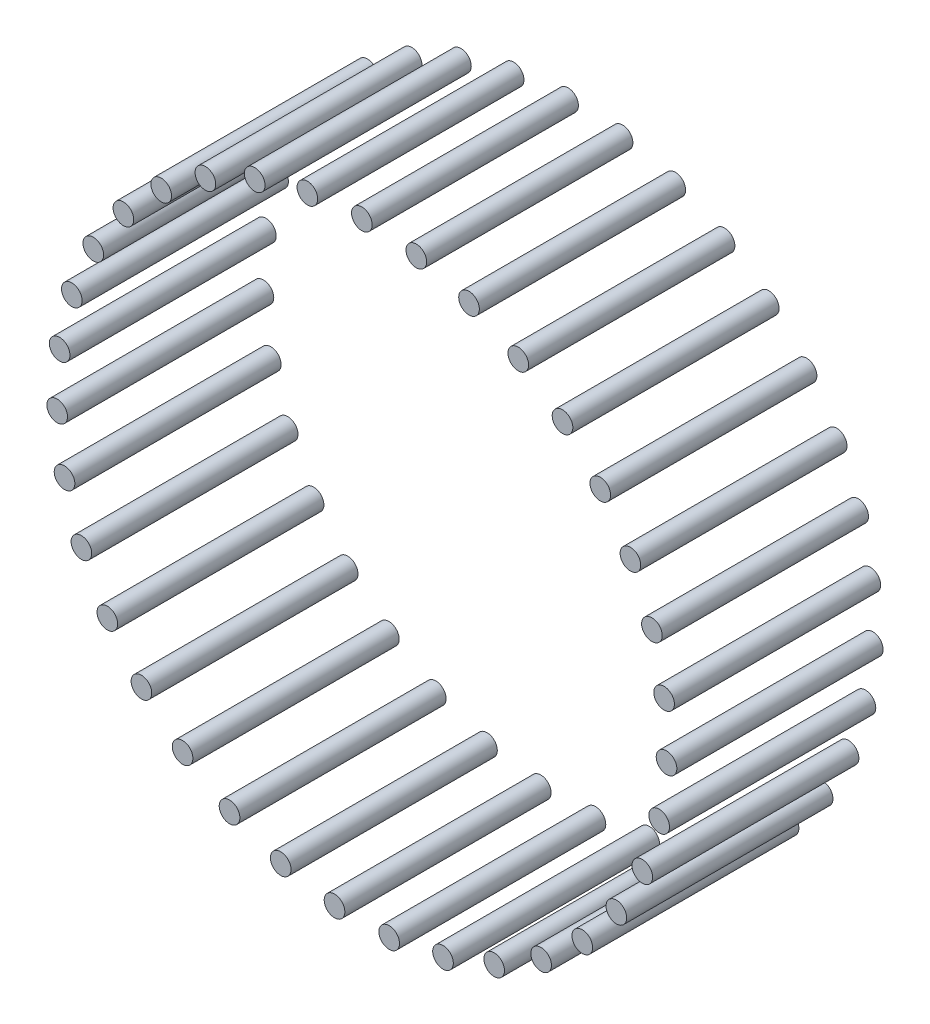
from build123d import *

# Parameters (mm, degrees)
SKETCH_1_R         = 1.75
EXTRUDE_1_DEPTH    = 35
EXTRUDE_1_2_DEPTH  = 35
EXTRUDE_1_3_DEPTH  = 35
EXTRUDE_1_4_DEPTH  = 35
EXTRUDE_1_5_DEPTH  = 35
EXTRUDE_1_6_DEPTH  = 35
EXTRUDE_1_7_DEPTH  = 35
EXTRUDE_1_8_DEPTH  = 35
EXTRUDE_1_9_DEPTH  = 35
EXTRUDE_1_10_DEPTH = 35
EXTRUDE_1_11_DEPTH = 35
EXTRUDE_1_12_DEPTH = 35
EXTRUDE_1_13_DEPTH = 35
EXTRUDE_1_14_DEPTH = 35
EXTRUDE_1_15_DEPTH = 35
EXTRUDE_1_16_DEPTH = 35
EXTRUDE_1_17_DEPTH = 35
EXTRUDE_1_18_DEPTH = 35
EXTRUDE_1_19_DEPTH = 35
EXTRUDE_1_20_DEPTH = 35
EXTRUDE_1_21_DEPTH = 35
EXTRUDE_1_22_DEPTH = 35
EXTRUDE_1_23_DEPTH = 35
EXTRUDE_1_24_DEPTH = 35
EXTRUDE_1_25_DEPTH = 35
EXTRUDE_1_26_DEPTH = 35
EXTRUDE_1_27_DEPTH = 35
EXTRUDE_1_28_DEPTH = 35
EXTRUDE_1_29_DEPTH = 35
EXTRUDE_1_30_DEPTH = 35
EXTRUDE_1_31_DEPTH = 35
EXTRUDE_1_32_DEPTH = 35
EXTRUDE_1_33_DEPTH = 35
EXTRUDE_1_34_DEPTH = 35
EXTRUDE_1_35_DEPTH = 35


with BuildPart() as part:
    # Эскиз1 → Бобышка-Вытянуть1 (new body)
    with BuildSketch(Plane.XY):
        with Locations((0, 51.75)):
            Circle(SKETCH_1_R)
    extrude(amount=EXTRUDE_1_DEPTH)


with BuildPart() as body_2:
    # Эскиз1 → Extrude 1 2 (new body)
    with BuildSketch(Plane.XY):
        with Locations((9.240319306, 50.91835621)):
            Circle(SKETCH_1_R)
    extrude(amount=EXTRUDE_1_2_DEPTH)


with BuildPart() as body_3:
    # Эскиз1 → Extrude 1 3 (new body)
    with BuildSketch(Plane.XY):
        with Locations((18.183647146, 48.450154556)):
            Circle(SKETCH_1_R)
    extrude(amount=EXTRUDE_1_3_DEPTH)


with BuildPart() as body_4:
    # Эскиз1 → Extrude 1 4 (new body)
    with BuildSketch(Plane.XY):
        with Locations((26.542537606, 44.424725069)):
            Circle(SKETCH_1_R)
    extrude(amount=EXTRUDE_1_4_DEPTH)


with BuildPart() as body_5:
    # Эскиз1 → Extrude 1 5 (new body)
    with BuildSketch(Plane.XY):
        with Locations((34.048329067, 38.971448366)):
            Circle(SKETCH_1_R)
    extrude(amount=EXTRUDE_1_5_DEPTH)


with BuildPart() as body_6:
    # Эскиз1 → Extrude 1 6 (new body)
    with BuildSketch(Plane.XY):
        with Locations((40.459779218, 32.265597246)):
            Circle(SKETCH_1_R)
    extrude(amount=EXTRUDE_1_6_DEPTH)


with BuildPart() as body_7:
    # Эскиз1 → Extrude 1 7 (new body)
    with BuildSketch(Plane.XY):
        with Locations((45.570818774, 24.522703283)):
            Circle(SKETCH_1_R)
    extrude(amount=EXTRUDE_1_7_DEPTH)


with BuildPart() as body_8:
    # Эскиз1 → Extrude 1 8 (new body)
    with BuildSketch(Plane.XY):
        with Locations((49.217174718, 15.991629459)):
            Circle(SKETCH_1_R)
    extrude(amount=EXTRUDE_1_8_DEPTH)


with BuildPart() as body_9:
    # Эскиз1 → Extrude 1 9 (new body)
    with BuildSketch(Plane.XY):
        with Locations((51.281650171, 6.946571506)):
            Circle(SKETCH_1_R)
    extrude(amount=EXTRUDE_1_9_DEPTH)


with BuildPart() as body_10:
    # Эскиз1 → Extrude 1 10 (new body)
    with BuildSketch(Plane.XY):
        with Locations((51.697891194, -2.321754971)):
            Circle(SKETCH_1_R)
    extrude(amount=EXTRUDE_1_10_DEPTH)


with BuildPart() as body_11:
    # Эскиз1 → Extrude 1 11 (new body)
    with BuildSketch(Plane.XY):
        with Locations((50.452519455, -11.515458332)):
            Circle(SKETCH_1_R)
    extrude(amount=EXTRUDE_1_11_DEPTH)


with BuildPart() as body_12:
    # Эскиз1 → Extrude 1 12 (new body)
    with BuildSketch(Plane.XY):
        with Locations((47.58556223, -20.339045388)):
            Circle(SKETCH_1_R)
    extrude(amount=EXTRUDE_1_12_DEPTH)


with BuildPart() as body_13:
    # Эскиз1 → Extrude 1 13 (new body)
    with BuildSketch(Plane.XY):
        with Locations((43.18916588, -28.50891879)):
            Circle(SKETCH_1_R)
    extrude(amount=EXTRUDE_1_13_DEPTH)


with BuildPart() as body_14:
    # Эскиз1 → Extrude 1 14 (new body)
    with BuildSketch(Plane.XY):
        with Locations((37.404634203, -35.762492085)):
            Circle(SKETCH_1_R)
    extrude(amount=EXTRUDE_1_14_DEPTH)


with BuildPart() as body_15:
    # Эскиз1 → Extrude 1 15 (new body)
    with BuildSketch(Plane.XY):
        with Locations((30.417886806, -41.866629459)):
            Circle(SKETCH_1_R)
    extrude(amount=EXTRUDE_1_15_DEPTH)


with BuildPart() as body_16:
    # Эскиз1 → Extrude 1 16 (new body)
    with BuildSketch(Plane.XY):
        with Locations((22.453483499, -46.625138914)):
            Circle(SKETCH_1_R)
    extrude(amount=EXTRUDE_1_16_DEPTH)


with BuildPart() as body_17:
    # Эскиз1 → Extrude 1 17 (new body)
    with BuildSketch(Plane.XY):
        with Locations((13.767406758, -49.885078041)):
            Circle(SKETCH_1_R)
    extrude(amount=EXTRUDE_1_17_DEPTH)


with BuildPart() as body_18:
    # Эскиз1 → Extrude 1 18 (new body)
    with BuildSketch(Plane.XY):
        with Locations((4.638834236, -51.541669714)):
            Circle(SKETCH_1_R)
    extrude(amount=EXTRUDE_1_18_DEPTH)


with BuildPart() as body_19:
    # Эскиз1 → Extrude 1 19 (new body)
    with BuildSketch(Plane.XY):
        with Locations((-4.638834236, -51.541669714)):
            Circle(SKETCH_1_R)
    extrude(amount=EXTRUDE_1_19_DEPTH)


with BuildPart() as body_20:
    # Эскиз1 → Extrude 1 20 (new body)
    with BuildSketch(Plane.XY):
        with Locations((-13.767406758, -49.885078041)):
            Circle(SKETCH_1_R)
    extrude(amount=EXTRUDE_1_20_DEPTH)


with BuildPart() as body_21:
    # Эскиз1 → Extrude 1 21 (new body)
    with BuildSketch(Plane.XY):
        with Locations((-22.453483499, -46.625138914)):
            Circle(SKETCH_1_R)
    extrude(amount=EXTRUDE_1_21_DEPTH)


with BuildPart() as body_22:
    # Эскиз1 → Extrude 1 22 (new body)
    with BuildSketch(Plane.XY):
        with Locations((-30.417886806, -41.866629459)):
            Circle(SKETCH_1_R)
    extrude(amount=EXTRUDE_1_22_DEPTH)


with BuildPart() as body_23:
    # Эскиз1 → Extrude 1 23 (new body)
    with BuildSketch(Plane.XY):
        with Locations((-37.404634203, -35.762492085)):
            Circle(SKETCH_1_R)
    extrude(amount=EXTRUDE_1_23_DEPTH)


with BuildPart() as body_24:
    # Эскиз1 → Extrude 1 24 (new body)
    with BuildSketch(Plane.XY):
        with Locations((-43.18916588, -28.50891879)):
            Circle(SKETCH_1_R)
    extrude(amount=EXTRUDE_1_24_DEPTH)


with BuildPart() as body_25:
    # Эскиз1 → Extrude 1 25 (new body)
    with BuildSketch(Plane.XY):
        with Locations((-47.58556223, -20.339045388)):
            Circle(SKETCH_1_R)
    extrude(amount=EXTRUDE_1_25_DEPTH)


with BuildPart() as body_26:
    # Эскиз1 → Extrude 1 26 (new body)
    with BuildSketch(Plane.XY):
        with Locations((-50.452519455, -11.515458332)):
            Circle(SKETCH_1_R)
    extrude(amount=EXTRUDE_1_26_DEPTH)


with BuildPart() as body_27:
    # Эскиз1 → Extrude 1 27 (new body)
    with BuildSketch(Plane.XY):
        with Locations((-51.697891194, -2.321754971)):
            Circle(SKETCH_1_R)
    extrude(amount=EXTRUDE_1_27_DEPTH)


with BuildPart() as body_28:
    # Эскиз1 → Extrude 1 28 (new body)
    with BuildSketch(Plane.XY):
        with Locations((-51.281650171, 6.946571506)):
            Circle(SKETCH_1_R)
    extrude(amount=EXTRUDE_1_28_DEPTH)


with BuildPart() as body_29:
    # Эскиз1 → Extrude 1 29 (new body)
    with BuildSketch(Plane.XY):
        with Locations((-49.217174718, 15.991629459)):
            Circle(SKETCH_1_R)
    extrude(amount=EXTRUDE_1_29_DEPTH)


with BuildPart() as body_30:
    # Эскиз1 → Extrude 1 30 (new body)
    with BuildSketch(Plane.XY):
        with Locations((-45.570818774, 24.522703283)):
            Circle(SKETCH_1_R)
    extrude(amount=EXTRUDE_1_30_DEPTH)


with BuildPart() as body_31:
    # Эскиз1 → Extrude 1 31 (new body)
    with BuildSketch(Plane.XY):
        with Locations((-40.459779218, 32.265597246)):
            Circle(SKETCH_1_R)
    extrude(amount=EXTRUDE_1_31_DEPTH)


with BuildPart() as body_32:
    # Эскиз1 → Extrude 1 32 (new body)
    with BuildSketch(Plane.XY):
        with Locations((-34.048329067, 38.971448366)):
            Circle(SKETCH_1_R)
    extrude(amount=EXTRUDE_1_32_DEPTH)


with BuildPart() as body_33:
    # Эскиз1 → Extrude 1 33 (new body)
    with BuildSketch(Plane.XY):
        with Locations((-26.542537606, 44.424725069)):
            Circle(SKETCH_1_R)
    extrude(amount=EXTRUDE_1_33_DEPTH)


with BuildPart() as body_34:
    # Эскиз1 → Extrude 1 34 (new body)
    with BuildSketch(Plane.XY):
        with Locations((-18.183647146, 48.450154556)):
            Circle(SKETCH_1_R)
    extrude(amount=EXTRUDE_1_34_DEPTH)


with BuildPart() as body_35:
    # Эскиз1 → Extrude 1 35 (new body)
    with BuildSketch(Plane.XY):
        with Locations((-9.240319306, 50.91835621)):
            Circle(SKETCH_1_R)
    extrude(amount=EXTRUDE_1_35_DEPTH)


solid = Compound([part.part, body_2.part, body_3.part, body_4.part, body_5.part, body_6.part, body_7.part, body_8.part, body_9.part, body_10.part, body_11.part, body_12.part, body_13.part, body_14.part, body_15.part, body_16.part, body_17.part, body_18.part, body_19.part, body_20.part, body_21.part, body_22.part, body_23.part, body_24.part, body_25.part, body_26.part, body_27.part, body_28.part, body_29.part, body_30.part, body_31.part, body_32.part, body_33.part, body_34.part, body_35.part])
